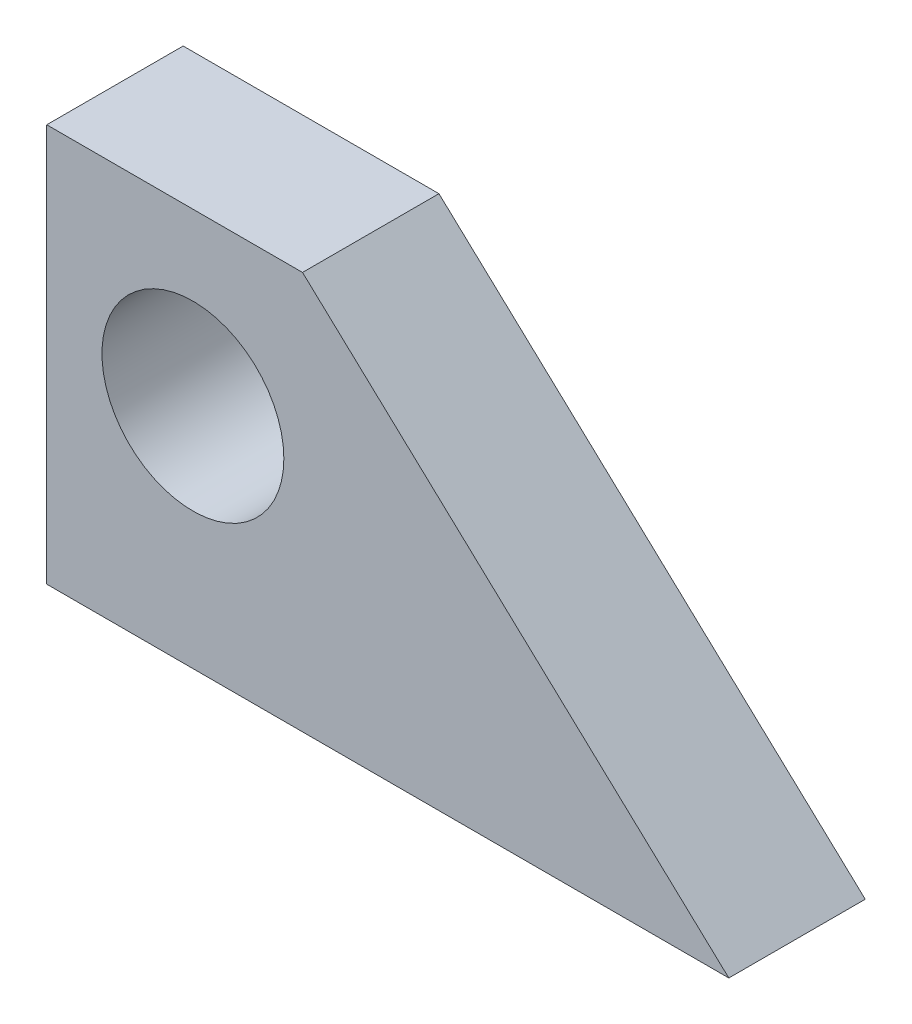
from build123d import *

# Parameters (mm, degrees)
BOSS_EXTRUDE1_DEPTH      = 3
BOSS_EXTRUDE1_DEPTH_BACK = 3
SKETCH2_R                = 4
CUT_EXTRUDE1_DEPTH       = 10


with BuildPart() as part:
    # Sketch1 → Boss-Extrude1 (new, two sides: drawn at the far end of the back side and taken through both)
    with BuildSketch(Plane.XY.offset(-BOSS_EXTRUDE1_DEPTH_BACK)):
        Polygon((8.571428571, -10), (23.571428571, -10), (4.821428571, 7.5), (-6.428571429, 7.5), (-6.428571429, -10), align=None)
    extrude(amount=BOSS_EXTRUDE1_DEPTH + BOSS_EXTRUDE1_DEPTH_BACK)

    # Sketch2 → Cut-Extrude1 (cut)
    with BuildSketch(Plane.XY.offset(3)):
        Circle(SKETCH2_R)
    extrude(amount=-CUT_EXTRUDE1_DEPTH, mode=Mode.SUBTRACT)


solid = part.part
